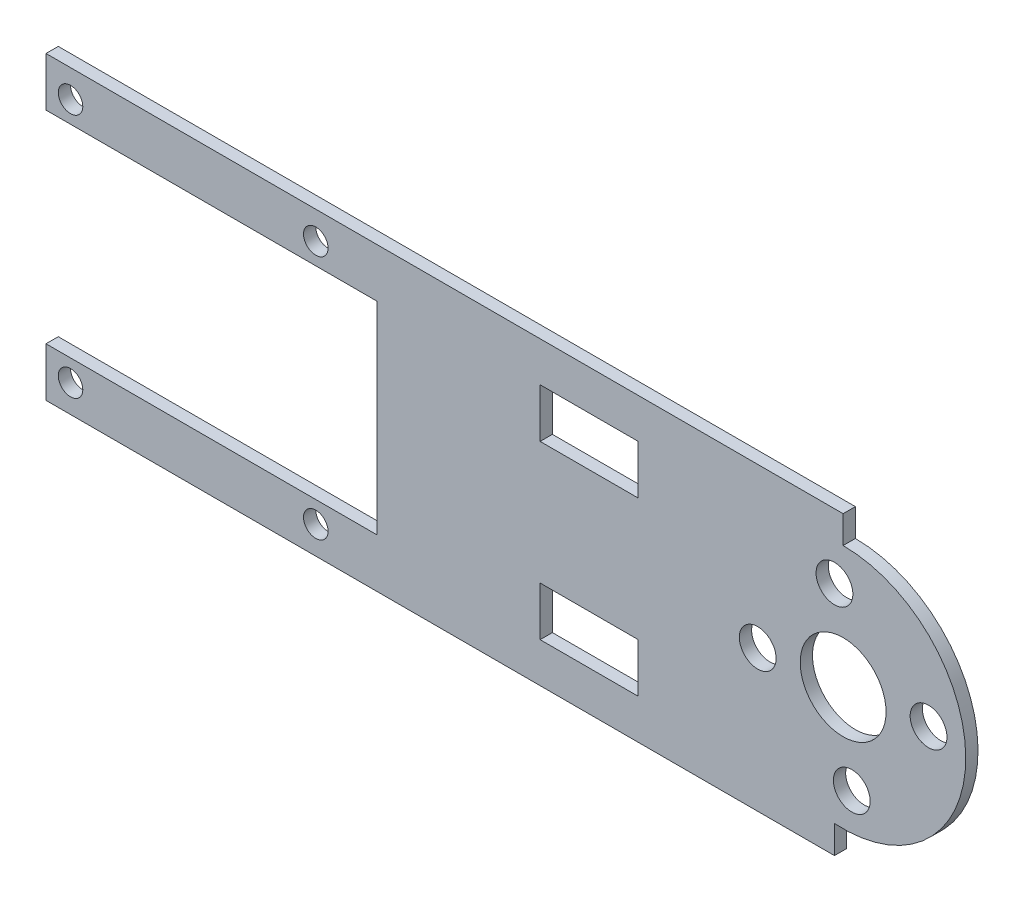
from build123d import *

# Parameters (mm, degrees)
SKETCH1_R           = 1.5
SKETCH1_R_2         = 3.5
SKETCH1_R_3         = 1
SKETCH1_W           = 8
SKETCH1_H           = 4
BOSS_EXTRUDE1_DEPTH = 1


with BuildPart() as part:
    # Sketch1 → Boss-Extrude1 (new body)
    with BuildSketch(Plane.XY):
        with BuildLine():
            Line((-4.12667801, 12.25), (5.87332199, 12.25))
            Line((5.87332199, 12.25), (40.87332199, 12.25))
            Line((40.87332199, 12.25), (40.87332199, 10))
            ThreePointArc((40.87332199, 10), (50.867066736, -0.353646663), (40.166471095, -9.974986808))
            Line((40.166471095, -9.974986808), (40.166471095, -12.25))
            Line((40.166471095, -12.25), (5.87332199, -12.25))
            Line((5.87332199, -12.25), (-4.12667801, -12.25))
            Line((-4.12667801, -12.25), (-24.12667801, -12.25))
            Line((-24.12667801, -12.25), (-24.12667801, -8.25))
            Line((-24.12667801, -8.25), (2.87332199, -8.25))
            Line((2.87332199, -8.25), (2.87332199, 8.25))
            Line((2.87332199, 8.25), (-24.12667801, 8.25))
            Line((-24.12667801, 8.25), (-24.12667801, 12.25))
            Line((-24.12667801, 12.25), (-4.12667801, 12.25))
        make_face()
        with Locations((40.166439084, 6.964216866)):
            Circle(SKETCH1_R, mode=Mode.SUBTRACT)
        with Locations((47.837538856, 0.706882906)):
            Circle(SKETCH1_R, mode=Mode.SUBTRACT)
        with Locations((41.580204896, -6.964216866)):
            Circle(SKETCH1_R, mode=Mode.SUBTRACT)
        with Locations((33.909105124, -0.706882906)):
            Circle(SKETCH1_R, mode=Mode.SUBTRACT)
        with Locations((40.87332199, 0)):
            Circle(SKETCH1_R_2, mode=Mode.SUBTRACT)
        with Locations((-2.12667801, 10)):
            Circle(SKETCH1_R_3, mode=Mode.SUBTRACT)
        with Locations((-2.12667801, -10)):
            Circle(SKETCH1_R_3, mode=Mode.SUBTRACT)
        with Locations((-22.12667801, 10)):
            Circle(SKETCH1_R_3, mode=Mode.SUBTRACT)
        with Locations((-22.12667801, -10)):
            Circle(SKETCH1_R_3, mode=Mode.SUBTRACT)
        with Locations((20.166471095, 7)):
            Rectangle(SKETCH1_W, SKETCH1_H, mode=Mode.SUBTRACT)
        with Locations((20.166471095, -7)):
            Rectangle(SKETCH1_W, SKETCH1_H, mode=Mode.SUBTRACT)
    extrude(amount=BOSS_EXTRUDE1_DEPTH)


solid = part.part
